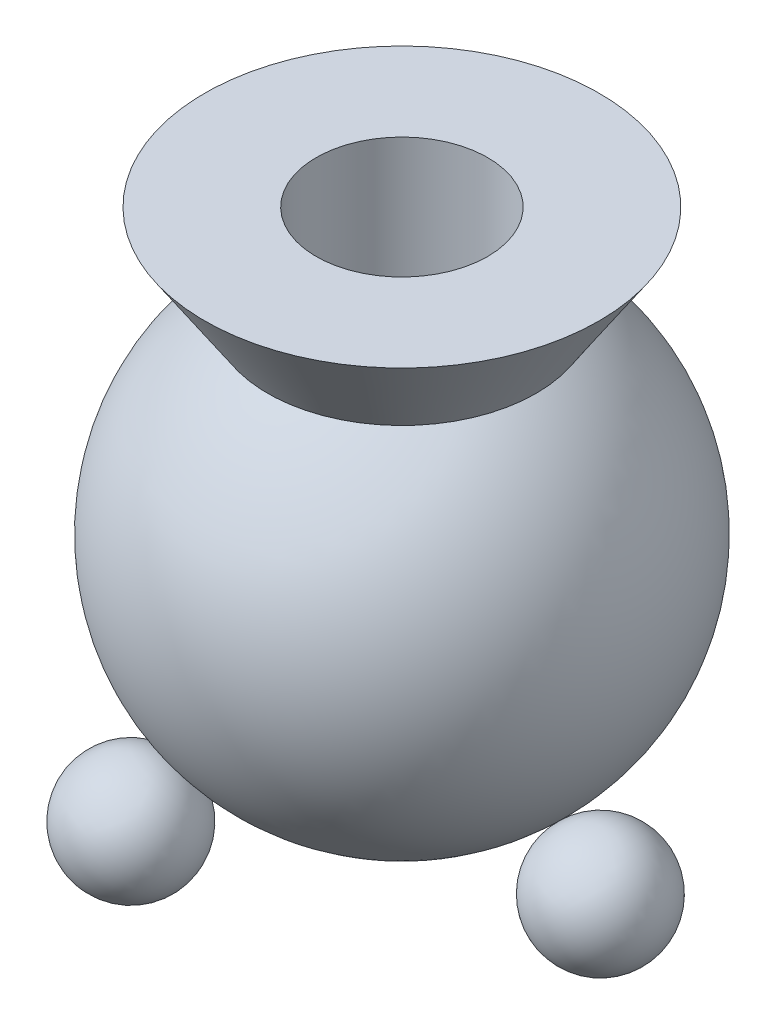
from build123d import *

# Parameters (mm, degrees)
CIRPATTERN1_COUNT = 3


with BuildPart() as part:
    # Sketch1 → Revolve1 (revolve)
    with BuildSketch(Plane.XY):
        with BuildLine():
            Line((0, 0), (0, 40))
            Line((0, 40), (10, 40))
            Line((10, 40), (10, 60))
            Line((10, 60), (23, 60))
            Line((23, 60), (15.652475842, 49))
            ThreePointArc((15.652475842, 49), (25.719642299, 18.784161637), (0, 0))
        make_face()
    revolve(axis=Axis((0, 0, 0), (0, 1, 0)))


with BuildPart() as body_2:
    # Sketch2 → Revolve2 (revolve)
    with BuildSketch(Plane.XY):
        with BuildLine():
            Line((18.415875664, 7.255240606), (27.871123101, -2.882294478))
            ThreePointArc((27.871123101, -2.882294478), (28.212266925, 6.914096782), (18.415875664, 7.255240606))
        make_face()
    revolve(axis=Axis((18.415875664, 7.255240606, 0), (0.6820694690341359, -0.7312873849667394, 0)))


with BuildPart() as cirpattern1_1:
    # CirPattern1: pattern copy
    add(body_2.part.rotate(Axis((0, 0, 0), (0, 1, 0)), 1 * 360 / CIRPATTERN1_COUNT))


with BuildPart() as cirpattern1_2:
    # CirPattern1: pattern copy
    add(body_2.part.rotate(Axis((0, 0, 0), (0, 1, 0)), 2 * 360 / CIRPATTERN1_COUNT))


solid = Compound([part.part, body_2.part, cirpattern1_1.part, cirpattern1_2.part])
